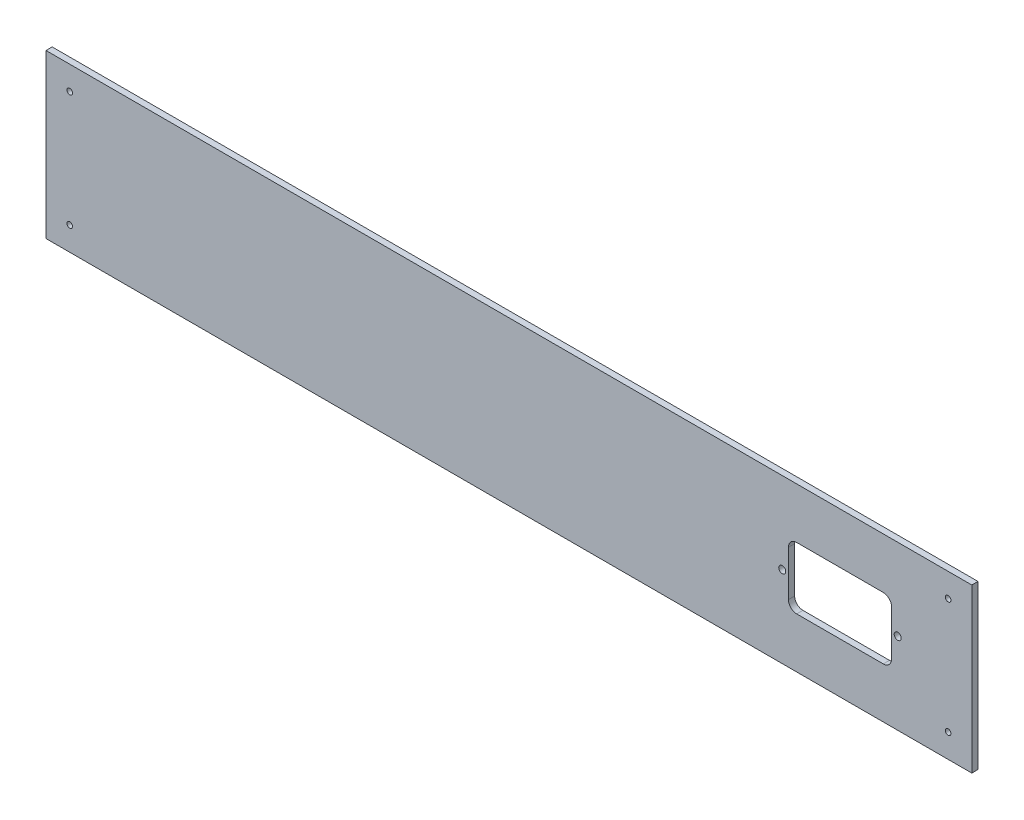
from build123d import *

# Parameters (mm, degrees)
SKETCH_F_W                   = 449
SKETCH_F_H                   = 79
SKETCH_F_R                   = 1.361667817
ESTRUSIONE_ESTRUSIONE1_DEPTH = 3
SKETCH1_R                    = 1.7
EXTRUDE1_DEPTH               = 456.906788719


with BuildPart() as part:
    # Sketch f → Estrusione-Estrusione1 (new body)
    with BuildSketch(Plane.XY):
        with Locations((224.5, 39.5)):
            Rectangle(SKETCH_F_W, SKETCH_F_H)
        with Locations((11.5, 67.5)):
            Circle(SKETCH_F_R, mode=Mode.SUBTRACT)
        with Locations(Location((437.5, 67.5, 0), (0, 0, 180))):
            Circle(SKETCH_F_R, mode=Mode.SUBTRACT)
        with Locations(Location((11.5, 11.5, 0), (0, 0, 180))):
            Circle(SKETCH_F_R, mode=Mode.SUBTRACT)
        with Locations((437.5, 11.5)):
            Circle(SKETCH_F_R, mode=Mode.SUBTRACT)
    extrude(amount=ESTRUSIONE_ESTRUSIONE1_DEPTH)

    # Sketch1 → Extrude1 (cut, through all)
    with BuildSketch(Plane(origin=(0, 0, 0), x_dir=(-1, 0, 0), z_dir=(0, 0, -1))):
        with Locations((-413.061242298, 39.505506417)):
            Circle(SKETCH1_R)
        with Locations((-357.061242298, 39.505506417)):
            Circle(SKETCH1_R)
        with BuildLine():
            Line((-364.0746338, 54.394920259), (-406.0746338, 54.394920259))
            ThreePointArc((-406.0746338, 54.394920259), (-408.903060925, 53.223347384), (-410.0746338, 50.394920259))
            Line((-410.0746338, 50.394920259), (-410.0746338, 28.394920259))
            ThreePointArc((-410.0746338, 28.394920259), (-408.903060925, 25.566493134), (-406.0746338, 24.394920259))
            Line((-406.0746338, 24.394920259), (-364.0746338, 24.394920259))
            ThreePointArc((-364.0746338, 24.394920259), (-361.246206675, 25.566493134), (-360.0746338, 28.394920259))
            Line((-360.0746338, 28.394920259), (-360.0746338, 50.394920259))
            ThreePointArc((-360.0746338, 50.394920259), (-361.246206675, 53.223347384), (-364.0746338, 54.394920259))
        make_face()
    extrude(amount=-EXTRUDE1_DEPTH, mode=Mode.SUBTRACT)


solid = part.part
